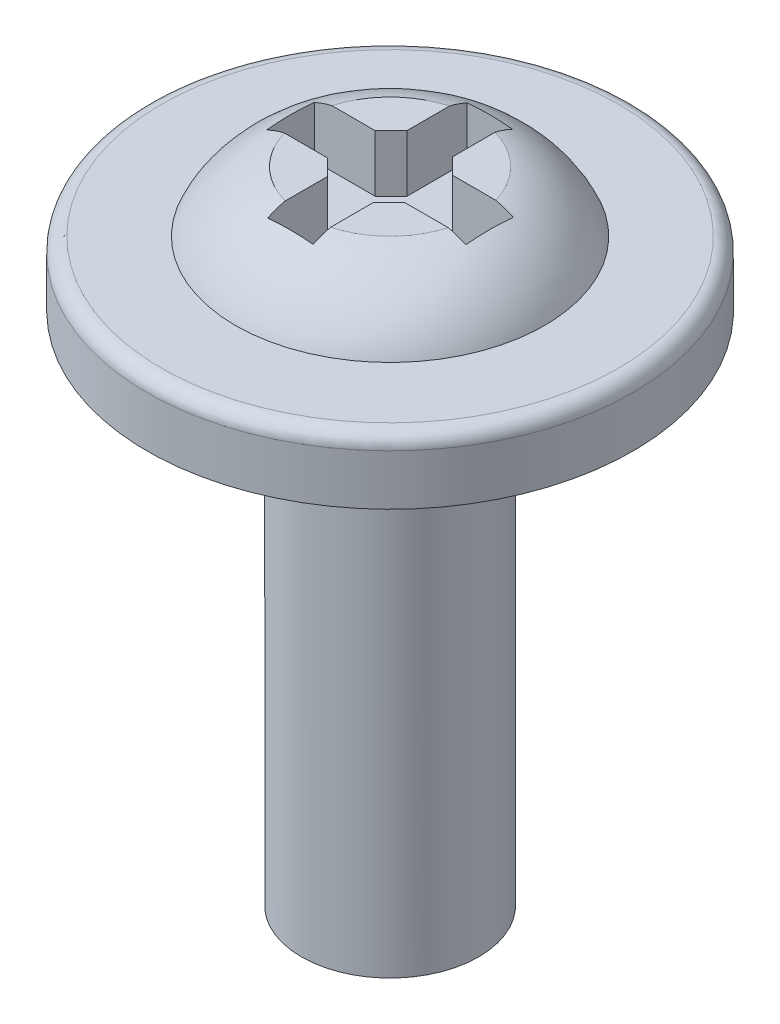
from build123d import *

# Parameters (mm, degrees)
SKETCH2_W          = 1.9812
SKETCH2_H          = 6.35
CUT_EXTRUDE1_DEPTH = 1.27
FILLET1_R          = 0.3175


with BuildPart() as part:
    # Sketch2 → Revolve2 (revolve)
    with BuildSketch(Plane(origin=(0, 0, 0), x_dir=(0, 0, -1), z_dir=(1, 0, 0))):
        with BuildLine():
            Line((0, 9.144), (0, 7.7978))
            Line((0, 7.7978), (3.4544, 7.7978))
            add(Edge.make_bspline(
                [(1.905, 9.144), (2.485859984, 9.013201575), (3.169812282, 8.481844182), (3.4544, 7.7978)],
                knots=[0, 0, 0, 0, 1, 1, 1, 1], degree=3))
            Line((1.905, 9.144), (0, 9.144))
        make_face()
        Polygon((0, 7.7978), (0, 6.35), (1.9812, 6.35), (5.4229, 6.35), (5.4229, 7.7978), (3.4544, 7.7978), align=None)
        with Locations((0.9906, 3.175)):
            Rectangle(SKETCH2_W, SKETCH2_H)
        Polygon((1.9812, -5.152618014), (0, -6.35), (0, 0), (1.9812, 0), align=None)
    revolve(axis=Axis((0, 0, 0), (0, 1, 0)))

    # Sketch4 → Cut-Extrude1 (cut)
    with BuildSketch(Plane(origin=(0, 9.144, 0), x_dir=(1, 0, 0), z_dir=(0, 1, 0))):
        Polygon((-0.508, 2.228840954), (0.508, 2.228840954), (0.508, 0.884564976), (0.861964761, 0.530600214), (2.223569071, 0.530600214), (2.223569071, -0.530600214), (0.861964761, -0.530600214), (0.508, -0.884564976), (0.508, -2.228840954), (-0.508, -2.228840954), (-0.508, -0.884564976), (-0.861964761, -0.530600214), (-2.223569071, -0.530600214), (-2.223569071, 0.530600214), (-0.861964761, 0.530600214), (-0.508, 0.884564976), align=None)
    extrude(amount=-CUT_EXTRUDE1_DEPTH, mode=Mode.SUBTRACT)

    # Fillet1
    fillet1_edges = [part.edges().sort_by_distance(p)[0] for p in [
        (0, 7.7978, 5.4229),
    ]]
    fillet(fillet1_edges, radius=FILLET1_R)


solid = part.part
